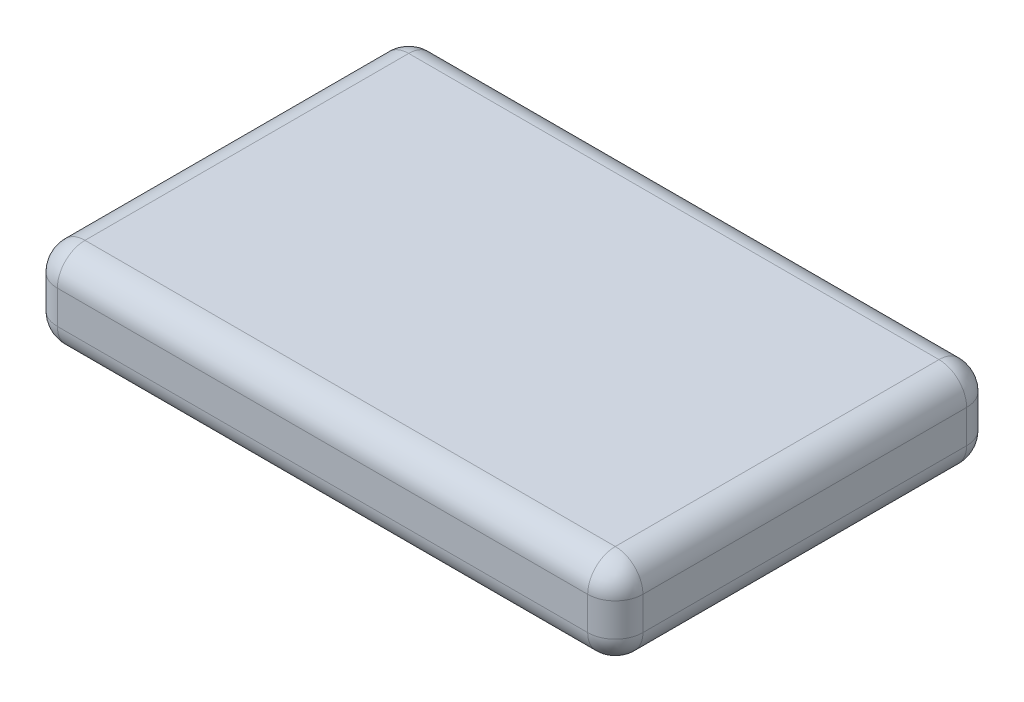
from build123d import *

# Parameters (mm, degrees)
SKETCH1_W           = 106
SKETCH1_H           = 68.6
BOSS_EXTRUDE1_DEPTH = 8
FILLET1_R           = 5
FILLET2_R           = 5


with BuildPart() as part:
    # Sketch1 → Boss-Extrude1 (new, symmetric)
    with BuildSketch(Plane(origin=(0, 0, 0), x_dir=(1, 0, 0), z_dir=(0, 1, 0))):
        Rectangle(SKETCH1_W, SKETCH1_H)
    extrude(amount=BOSS_EXTRUDE1_DEPTH, both=True)

    # Fillet1
    fillet1_edges = [part.edges().sort_by_distance(p)[0] for p in [
        (53, 0, 34.3),
        (-53, 0, 34.3),
        (-53, 0, -34.3),
        (53, 0, -34.3),
    ]]
    fillet(fillet1_edges, radius=FILLET1_R)

    # Fillet2
    fillet2_edges = [part.edges().sort_by_distance(p)[0] for p in [
        (-53, -8, 0),
        (-53, 8, 0),
        (53, -8, 0),
        (0, -8, 34.3),
        (0, -8, -34.3),
        (-51.535533906, -8, 32.835533906),
        (51.535533906, -8, 32.835533906),
        (51.535533906, -8, -32.835533906),
        (-51.535533906, -8, -32.835533906),
        (0, 8, -34.3),
        (53, 8, 0),
        (0, 8, 34.3),
        (-51.535533906, 8, 32.835533906),
        (51.535533906, 8, 32.835533906),
        (51.535533906, 8, -32.835533906),
        (-51.535533906, 8, -32.835533906),
    ]]
    fillet(fillet2_edges, radius=FILLET2_R)


solid = part.part
